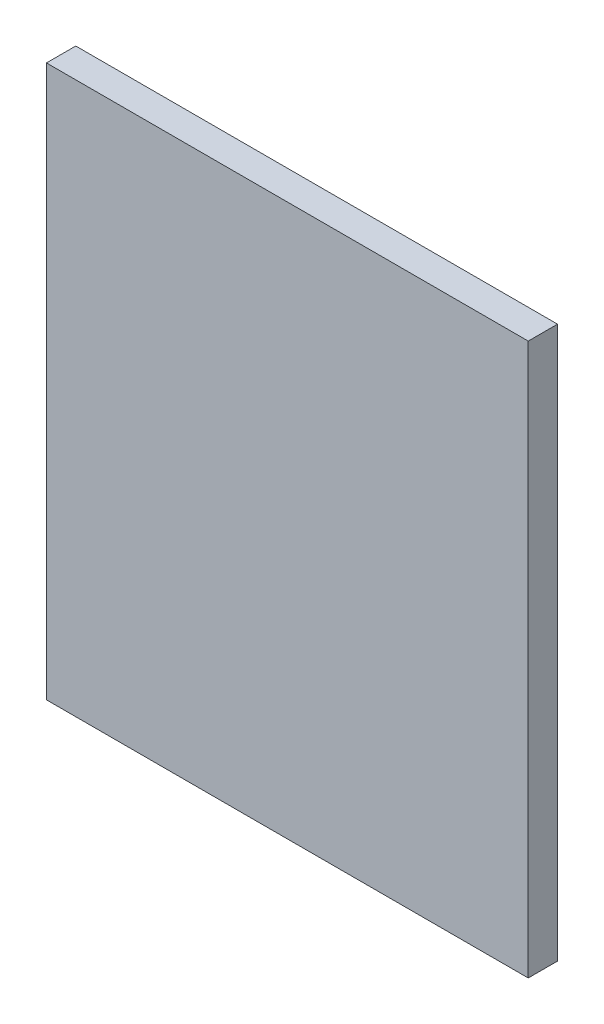
from build123d import *

# Parameters (mm, degrees)
SKETCH1_W           = 16.444009396
SKETCH1_H           = 18.827199164
BOSS_EXTRUDE1_DEPTH = 1


with BuildPart() as part:
    # Sketch1 → Boss-Extrude1 (new body)
    with BuildSketch(Plane.XY):
        with Locations((-35.271208559, 29.194074652)):
            Rectangle(SKETCH1_W, SKETCH1_H)
    extrude(amount=BOSS_EXTRUDE1_DEPTH)


solid = part.part
